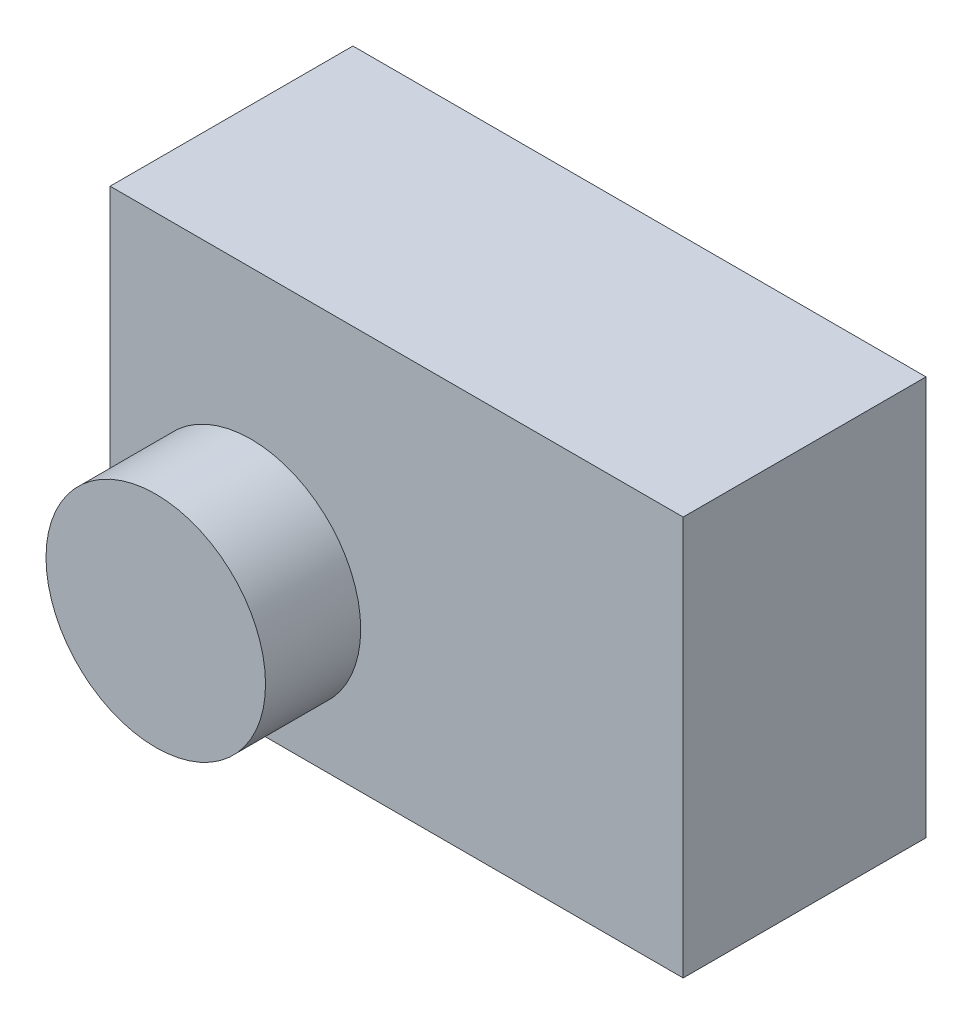
from build123d import *

# Parameters (mm, degrees)
ESBO_O1_W                = 59
ESBO_O1_H                = 41.1
RESSALTO_EXTRUS_O1_DEPTH = 25
ESBO_O2_R                = 11.3
RESSALTO_EXTRUS_O2_DEPTH = 9.8


with BuildPart() as part:
    # Esboço1 → Ressalto-extrusão1 (new body)
    with BuildSketch(Plane.XY):
        Rectangle(ESBO_O1_W, ESBO_O1_H)
    extrude(amount=RESSALTO_EXTRUS_O1_DEPTH)

    # Esboço2 → Ressalto-extrusão2 (add)
    with BuildSketch(Plane.XY.offset(25)):
        with Locations((-15, -6.05)):
            Circle(ESBO_O2_R)
    extrude(amount=RESSALTO_EXTRUS_O2_DEPTH)


solid = part.part
